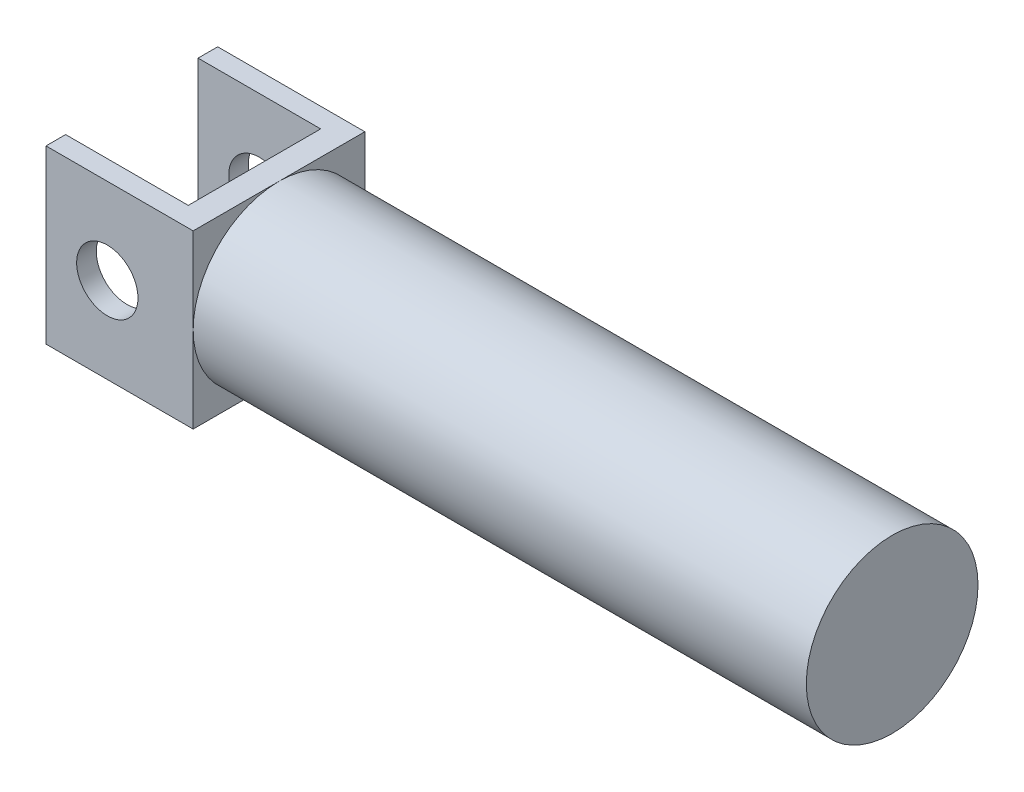
from build123d import *

# Parameters (mm, degrees)
SKETCH2_W           = 17.78
SKETCH2_H           = 17.78
BOSS_EXTRUDE1_DEPTH = 2.54
SKETCH3_R           = 8.89
BOSS_EXTRUDE2_DEPTH = 63.5
SKETCH4_W           = 17.78
SKETCH4_H           = 2.032
BOSS_EXTRUDE3_DEPTH = 12.7
SKETCH5_R           = 3.175
CUT_EXTRUDE1_DEPTH  = 69.966963831


with BuildPart() as part:
    # Sketch2 → Boss-Extrude1 (new body)
    with BuildSketch(Plane.YZ):
        Rectangle(SKETCH2_W, SKETCH2_H)
    extrude(amount=BOSS_EXTRUDE1_DEPTH)

    # Sketch3 → Boss-Extrude2 (add)
    with BuildSketch(Plane(origin=(2.54, 0, 0), x_dir=(0, 0, -1), z_dir=(1, 0, 0))):
        Circle(SKETCH3_R)
    extrude(amount=BOSS_EXTRUDE2_DEPTH)

    # Sketch4 → Boss-Extrude3 (add)
    with BuildSketch(Plane(origin=(0, 0, 0), x_dir=(0, -1, 0), z_dir=(-1, 0, 0))):
        with Locations((0, 7.874)):
            Rectangle(SKETCH4_W, SKETCH4_H)
        with Locations((0, -7.874)):
            Rectangle(SKETCH4_W, SKETCH4_H)
    extrude(amount=BOSS_EXTRUDE3_DEPTH)

    # Sketch5 → Cut-Extrude1 (cut, through all)
    with BuildSketch(Plane.XY.offset(8.89)):
        with Locations((-6.35, 0)):
            Circle(SKETCH5_R)
    extrude(amount=-CUT_EXTRUDE1_DEPTH, mode=Mode.SUBTRACT)


solid = part.part
